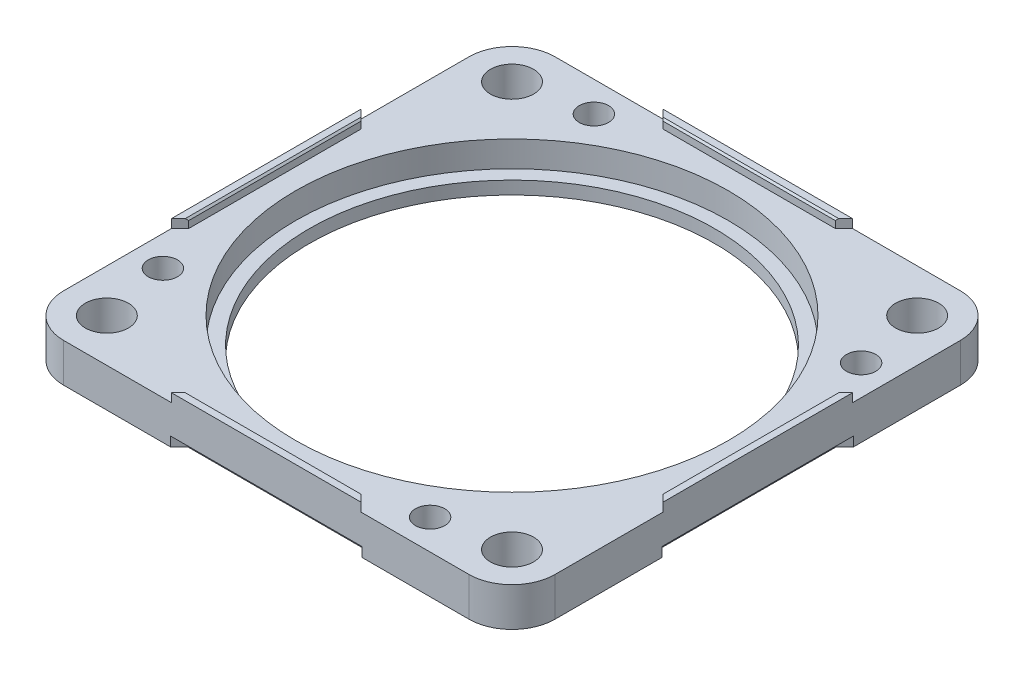
from build123d import *

# Parameters (mm, degrees)
SKETCH_1_W                           = 57
SKETCH_1_H                           = 57
EXTRUDE_1_DEPTH                      = 4.5
FILLET_1_R                           = 5
SKETCH_2_R                           = 25.1
CUT_EXTRUDE_1_DEPTH                  = 3
SKETCH_3_R                           = 23.5
CUT_EXTRUDE_2_DEPTH                  = 1.5
SKETCH_4_R                           = 2.5
SKETCH_4_R_2                         = 1.7
CUT_EXTRUDE_3_DEPTH                  = 4.5
EXTRUDE_2_DEPTH                      = 1
CHAMFER_1_SIZE                       = 0.2
CUT_EXTRUDE_4_DEPTH                  = 1.1
PATTERN_CIRCULAR_1_COUNT             = 4
CHAMFER_1_OF_PATTERN_CIRCULAR_1_SIZE = 0.2


with BuildPart() as part:
    # 草图1 → 凸台-拉伸1 (new body)
    with BuildSketch(Plane(origin=(0, 0, 0), x_dir=(1, 0, 0), z_dir=(0, 1, 0))):
        Rectangle(SKETCH_1_W, SKETCH_1_H)
    extrude(amount=EXTRUDE_1_DEPTH)

    # 圆角1
    fillet_1_edges = [part.edges().sort_by_distance(p)[0] for p in [
        (28.5, 2.25, 28.5),
        (-28.5, 2.25, 28.5),
        (-28.5, 2.25, -28.5),
        (28.5, 2.25, -28.5),
    ]]
    fillet(fillet_1_edges, radius=FILLET_1_R)

    # 草图2 → 切除-拉伸1 (cut)
    with BuildSketch(Plane(origin=(0, 4.5, 0), x_dir=(1, 0, 0), z_dir=(0, 1, 0))):
        with Locations(Location((0, 0, 0), (0, 0, 270))):
            Circle(SKETCH_2_R)
    extrude(amount=-CUT_EXTRUDE_1_DEPTH, mode=Mode.SUBTRACT)

    # 草图3 → 切除-拉伸2 (cut)
    with BuildSketch(Plane(origin=(0, 1.5, 0), x_dir=(1, 0, 0), z_dir=(0, 1, 0))):
        with Locations(Location((0, 0, 0), (0, 0, 270))):
            Circle(SKETCH_3_R)
    extrude(amount=-CUT_EXTRUDE_2_DEPTH, mode=Mode.SUBTRACT)

    # 草图4 → 切除-拉伸3 (cut)
    with BuildSketch(Plane(origin=(0, 4.5, 0), x_dir=(1, 0, 0), z_dir=(0, 1, 0))):
        with Locations(Location((-23.5, 23.5, 0), (0, 0, 270))):
            Circle(SKETCH_4_R)
        with Locations(Location((-15.5, 25, 0), (0, 0, 270))):
            Circle(SKETCH_4_R_2)
    cut_extrude_3 = extrude(amount=-CUT_EXTRUDE_3_DEPTH, mode=Mode.SUBTRACT)

    # 草图5 → 凸台-拉伸2 (add)
    with BuildSketch(Plane(origin=(0, 4.5, 0), x_dir=(1, 0, 0), z_dir=(0, 1, 0))):
        Polygon((-28.5, 11), (-28.5, -11), (-27.5, -10), (-27.5, 10), align=None)
    extrude_2 = extrude(amount=EXTRUDE_2_DEPTH)

    # 倒角1
    chamfer_1_edges = [part.edges().sort_by_distance(p)[0] for p in [
        (-27.5, 5.5, 0),
    ]]
    chamfer(chamfer_1_edges, length=CHAMFER_1_SIZE)

    # 草图6 → 切除-拉伸4 (cut)
    with BuildSketch(Plane.XZ):
        Polygon((-28.5, 11.1), (-28.5, -11.1), (-27.5, -10.1), (-27.5, 10.1), align=None)
    cut_extrude_4 = extrude(amount=-CUT_EXTRUDE_4_DEPTH, mode=Mode.SUBTRACT)

    # 阵列(圆周)1: 切除-拉伸3, 凸台-拉伸2, 切除-拉伸4 ×4 about axis
    pattern_circular_1_axis = Axis((0, 0, 0), (0, 1, 0))
    add([cut_extrude_3.rotate(pattern_circular_1_axis, i * 360 / PATTERN_CIRCULAR_1_COUNT) for i in range(1, PATTERN_CIRCULAR_1_COUNT)], mode=Mode.SUBTRACT)
    add([extrude_2.rotate(pattern_circular_1_axis, i * 360 / PATTERN_CIRCULAR_1_COUNT) for i in range(1, PATTERN_CIRCULAR_1_COUNT)])
    add([cut_extrude_4.rotate(pattern_circular_1_axis, i * 360 / PATTERN_CIRCULAR_1_COUNT) for i in range(1, PATTERN_CIRCULAR_1_COUNT)], mode=Mode.SUBTRACT)

    # 倒角1 of 阵列(圆周)1
    chamfer_1_of_pattern_circular_1_edges = [part.edges().sort_by_distance(p)[0] for p in [
        (0, 5.5, 27.5),
        (27.5, 5.5, 0),
        (0, 5.5, -27.5),
    ]]
    chamfer(chamfer_1_of_pattern_circular_1_edges, length=CHAMFER_1_OF_PATTERN_CIRCULAR_1_SIZE)


solid = part.part
